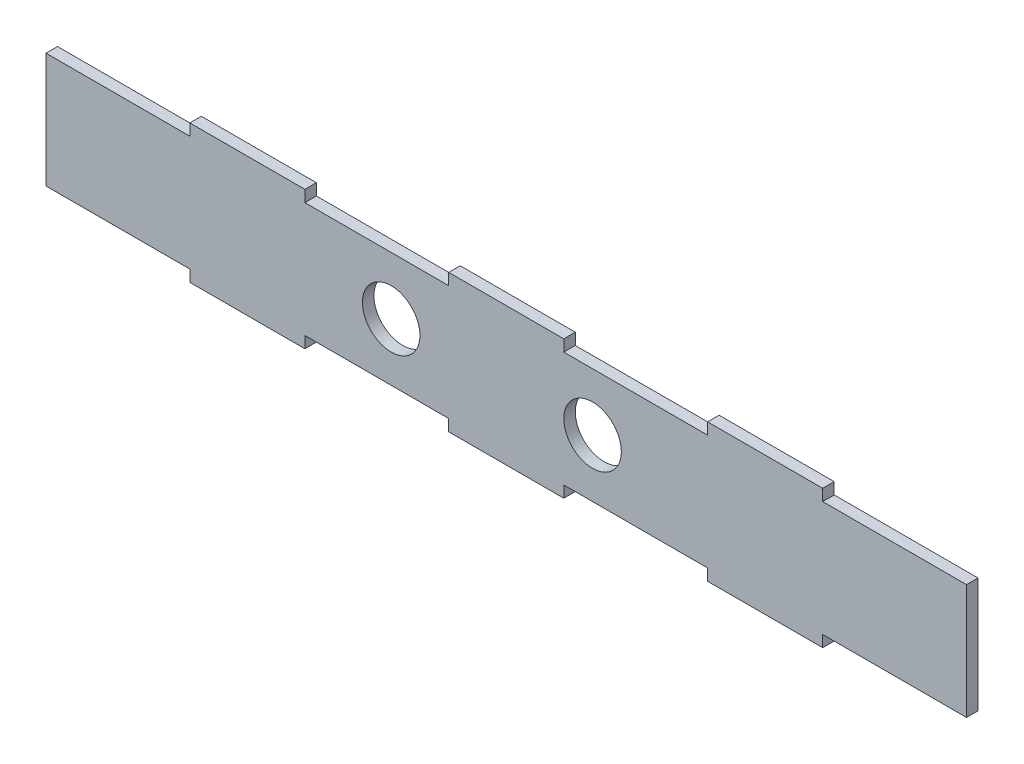
from build123d import *

# Parameters (mm, degrees)
SKETCH_1_R      = 5
EXTRUDE_1_DEPTH = 2


with BuildPart() as part:
    # Эскиз1 → Бобышка-Вытянуть1 (new body)
    with BuildSketch(Plane.XY):
        Polygon((25, 2), (25, 0), (45, 0), (45, 2), (70, 2), (70, 0), (90, 0), (90, 2), (115, 2), (115, 0), (135, 0), (135, 2), (160, 2), (160, 22), (135, 22), (135, 24), (115, 24), (115, 22), (90, 22), (90, 24), (70, 24), (70, 22), (45, 22), (45, 24), (25, 24), (25, 22), (0, 22), (0, 2), align=None)
        with Locations((60, 12)):
            Circle(SKETCH_1_R, mode=Mode.SUBTRACT)
        with Locations((95, 12)):
            Circle(SKETCH_1_R, mode=Mode.SUBTRACT)
    extrude(amount=EXTRUDE_1_DEPTH)


solid = part.part
